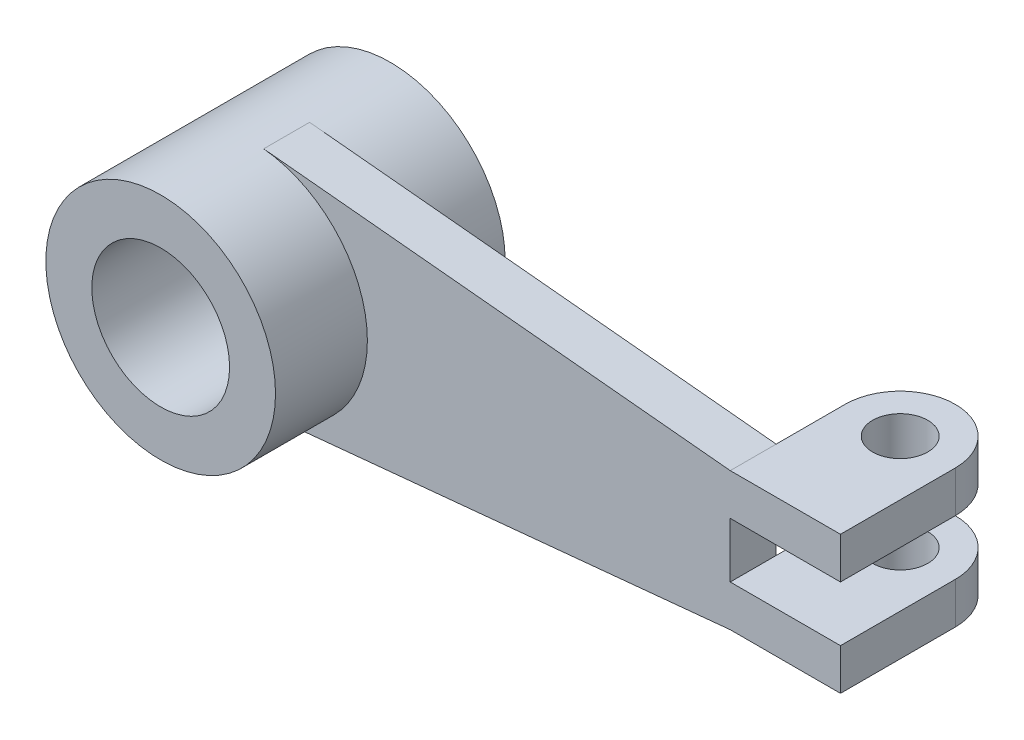
from build123d import *

# Parameters (mm, degrees)
SKETCH1_R           = 25
SKETCH1_R_2         = 15
BOSS_EXTRUDE1_DEPTH = 25
BOSS_EXTRUDE2_START = -30
BOSS_EXTRUDE2_DEPTH = 10
BOSS_EXTRUDE3_START = 15
BOSS_EXTRUDE3_DEPTH = 9
HOLE1_D             = 12


with BuildPart() as part:
    # Sketch1 → Boss-Extrude1 (new, symmetric)
    with BuildSketch(Plane.XY):
        Circle(SKETCH1_R)
        Circle(SKETCH1_R_2, mode=Mode.SUBTRACT)
    extrude(amount=BOSS_EXTRUDE1_DEPTH, both=True)

    # Sketch3 → Boss-Extrude2 (add)
    with BuildSketch(Plane(origin=(0, 0, -25), x_dir=(-1, 0, 0), z_dir=(0, 0, -1)).offset(BOSS_EXTRUDE2_START)):
        with BuildLine():
            Line((-104, 15), (-104, -15))
            Line((-104, -15), (-2.420790466, -24.882519437))
            ThreePointArc((-2.420790466, -24.882519437), (-25, 0), (-2.420790466, 24.882519437))
            Line((-2.420790466, 24.882519437), (-104, 15))
        make_face()
    extrude(amount=BOSS_EXTRUDE2_DEPTH)

    # Sketch6 → Boss-Extrude3 (add)
    with BuildSketch(Plane(origin=(0, 0, 0), x_dir=(1, 0, 0), z_dir=(0, 1, 0)).offset(BOSS_EXTRUDE3_START)):
        with BuildLine():
            Line((104, -5), (104, 20))
            ThreePointArc((104, 20), (116, 32), (128, 20))
            Line((128, 20), (128, -5))
            Line((128, -5), (104, -5))
        make_face()
    boss_extrude3 = extrude(amount=-BOSS_EXTRUDE3_DEPTH)

    # Mirror1: Boss-Extrude3 across plane
    add(boss_extrude3.mirror(Plane.ZX))

    # Hole1 (through all)
    with Locations(Plane(origin=(0, 15, 0), x_dir=(1, 0, 0), z_dir=(0, 1, 0))):
        with Locations((116, 20)):
            Hole(HOLE1_D / 2)


solid = part.part
